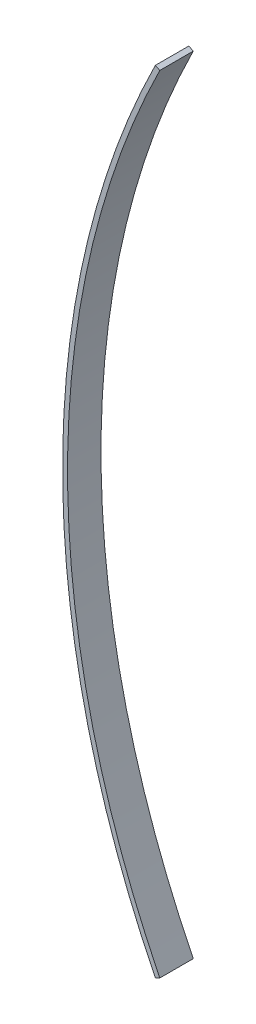
from build123d import *

# Parameters (mm, degrees)
EXTRUDE_THIN1_DEPTH = 6.75


with BuildPart() as part:
    # Sketch1 → Extrude-Thin1 (new body)
    with BuildSketch(Plane.XY):
        with BuildLine():
            ThreePointArc((18.613618726, 163.573065778), (0, 84.268032687), (18.613618726, 4.962999596))
            Line((18.613618726, 4.962999596), (17.718042954, 4.518090574))
            ThreePointArc((17.718042954, 4.518090574), (-1, 84.268032687), (17.718042954, 164.017974799))
            Line((17.718042954, 164.017974799), (18.613618726, 163.573065778))
        make_face()
    extrude(amount=-EXTRUDE_THIN1_DEPTH)


solid = part.part
